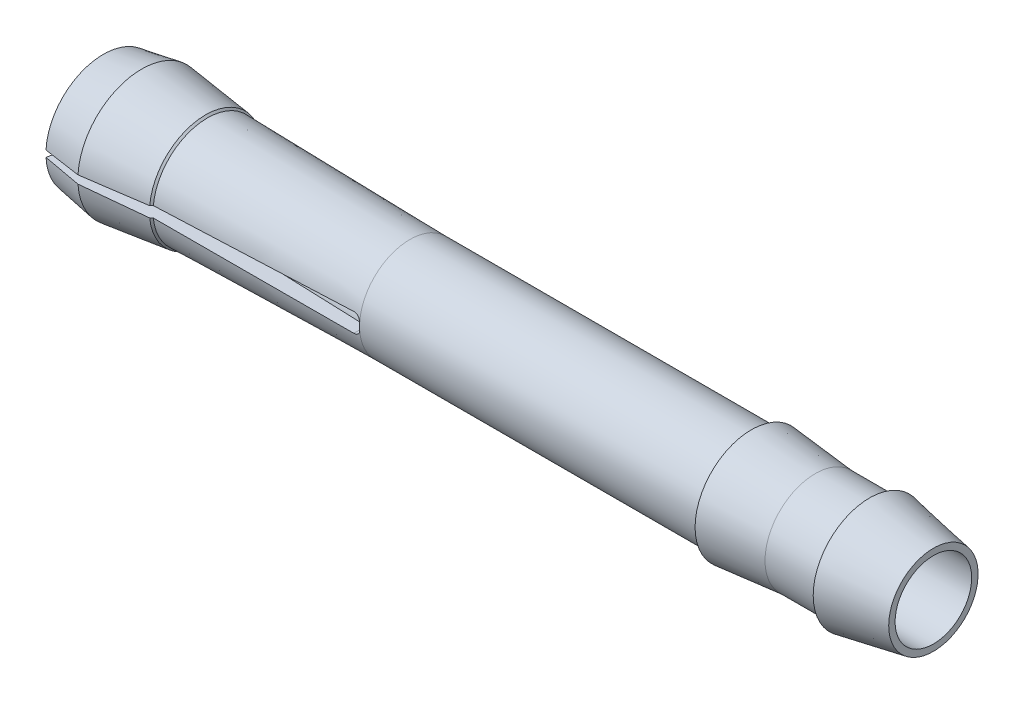
from build123d import *

# Parameters (mm, degrees)
CORTE_EXTRUS_O1_DEPTH = 5


with BuildPart() as part:
    # Esboço1 → Revolução1 (revolve)
    with BuildSketch(Plane.XY, mode=Mode.PRIVATE) as revolu_o1_sk:
        Polygon((0.133333333, 1), (0, 1.8), (1.2, 2), (3.2, 1.756376953), (3.256376953, 1.7), (9.6, 1.575), (20.3, 1.575), (20.3, 1.765), (22.3, 1.575), (24, 1.575), (24, 1.765), (26, 1.4), (26, 1.2), (9.6, 1.2), align=None)
    revolve(revolu_o1_sk.sketch.rotate(Axis((0, 0, 0), (1, 0, 0)), 90), axis=Axis((0, 0, 0), (1, 0, 0)))

    # Esboço2 → Corte-extrusão1 (cut, symmetric)
    with BuildSketch(Plane.XY):
        with BuildLine():
            Line((0, 0.1), (9.395834237, 0.295746547))
            ThreePointArc((9.395834237, 0.295746547), (9.539940787, 0.238676521), (9.6, 0.095789935))
            Line((9.6, 0.095789935), (9.6, -0.095789935))
            ThreePointArc((9.6, -0.095789935), (9.539940787, -0.238676521), (9.395834237, -0.295746547))
            Line((9.395834237, -0.295746547), (0, -0.1))
            Line((0, -0.1), (0, 0.1))
        make_face()
    extrude(amount=CORTE_EXTRUS_O1_DEPTH, both=True, mode=Mode.SUBTRACT)


solid = part.part
